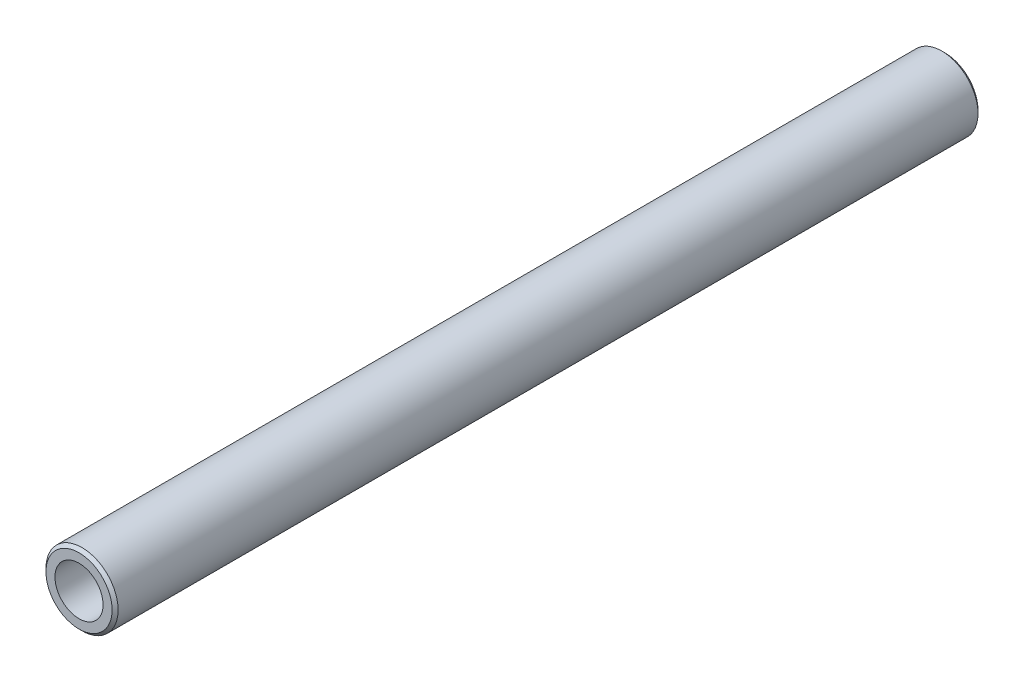
from build123d import *

# Parameters (mm, degrees)
ESBO_O1_R                = 3
RESSALTO_EXTRUS_O1_DEPTH = 36
CHANFRO1_SIZE            = 0.25
ESBO_O2_R                = 2
CORTE_EXTRUS_O1_DEPTH    = 16


with BuildPart() as part:
    # Esboço1 → Ressalto-extrusão1 (new, symmetric)
    with BuildSketch(Plane.XY):
        Circle(ESBO_O1_R)
    extrude(amount=RESSALTO_EXTRUS_O1_DEPTH, both=True)

    # Chanfro1
    chanfro1_edges = [part.edges().sort_by_distance(p)[0] for p in [
        (-3, 0, -36),
        (-3, 0, 36),
    ]]
    chamfer(chanfro1_edges, length=CHANFRO1_SIZE)

    # Esboço2 → Corte-extrusão1 (cut)
    with BuildSketch(Plane.XY.offset(36)):
        Circle(ESBO_O2_R)
    corte_extrus_o1 = extrude(amount=-CORTE_EXTRUS_O1_DEPTH, mode=Mode.SUBTRACT)

    # Espelhar1: Corte-extrusão1 across plane
    add(corte_extrus_o1.mirror(Plane.XY), mode=Mode.SUBTRACT)


solid = part.part
